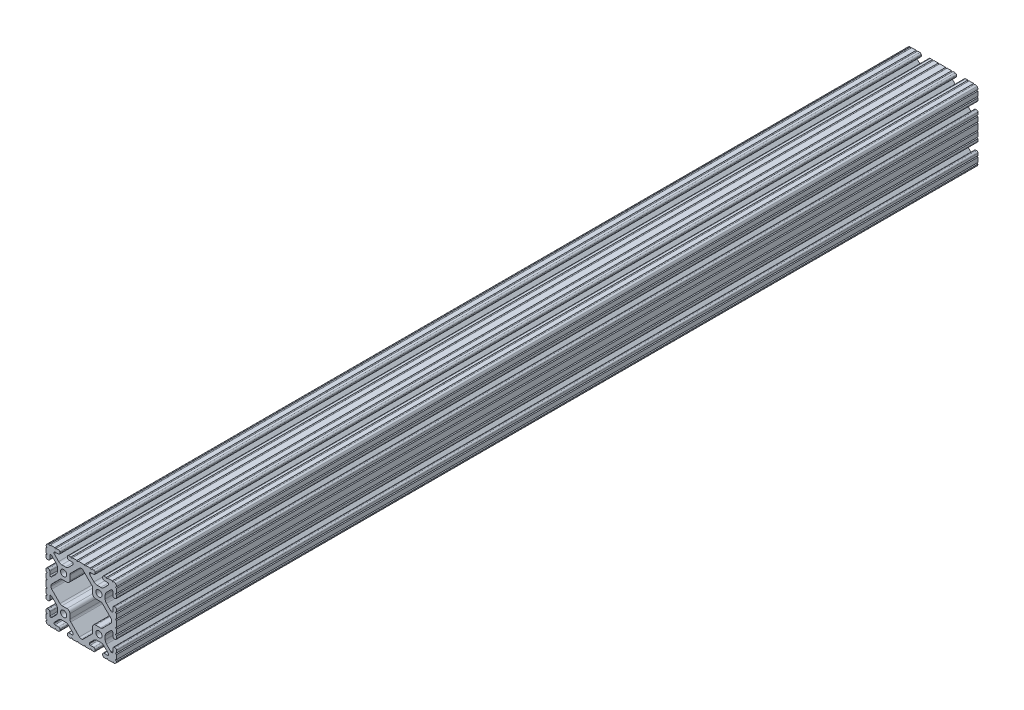
from build123d import *

# Parameters (mm, degrees)
BOSS_EXTRUDE1_DEPTH      = 465
BOSS_EXTRUDE1_DEPTH_BACK = 465
SKETCH3_R                = 3.3274


with BuildPart() as part:
    # Sketch3 → Boss-Extrude1 (new, two sides: drawn at the far end of the back side and taken through both)
    with BuildSketch(Plane.XY.offset(-BOSS_EXTRUDE1_DEPTH_BACK)):
        with BuildLine():
            Line((34.036, 28.448), (34.036, 24.630196049))
            ThreePointArc((34.036, 24.630196049), (34.497248241, 23.51664429), (35.6108, 23.055396049))
            Line((35.6108, 23.055396049), (36.525200183, 23.055396049))
            ThreePointArc((36.525200183, 23.055396049), (37.638751813, 23.516644236), (38.1, 24.630195866))
            Line((38.1, 24.630195866), (38.1, 27.023826138))
            ThreePointArc((38.1, 27.023826138), (37.117780706, 27.7845421), (38.1, 28.545258062))
            Line((38.1, 28.545258062), (38.1, 33.373016026))
            ThreePointArc((38.1, 33.373016026), (37.141472621, 34.109236774), (38.1, 34.845457521))
            ThreePointArc((38.1, 34.845457521), (37.837757813, 36.120195002), (37.086123144, 37.182631793))
            ThreePointArc((37.086123144, 37.182631793), (36.106286572, 37.843374398), (34.952681874, 38.1))
            ThreePointArc((34.952681874, 38.1), (34.190730434, 37.320215335), (33.428778994, 38.1))
            Line((33.428778994, 38.1), (28.601105935, 38.1))
            ThreePointArc((28.601105935, 38.1), (27.839158581, 37.32021942), (27.077211227, 38.1))
            Line((27.077211227, 38.1), (24.6888, 38.1))
            ThreePointArc((24.6888, 38.1), (23.575248241, 37.638751759), (23.114, 36.5252))
            Line((23.114, 36.5252), (23.114, 35.6108))
            ThreePointArc((23.114, 35.6108), (23.575248241, 34.497248241), (24.6888, 34.036))
            Line((24.6888, 34.036), (28.448, 34.036))
            ThreePointArc((28.448, 34.036), (29.076617928, 33.775617928), (29.337, 33.147))
            Line((29.337, 33.147), (29.337, 32.720693454))
            ThreePointArc((29.337, 32.720693454), (29.326675076, 32.273872751), (29.100231244, 31.888543625))
            Line((29.100231244, 31.888543625), (24.409287499, 27.197588341))
            ThreePointArc((24.409287499, 27.197588341), (22.868340045, 26.167958114), (21.050667579, 25.8064))
            Line((21.050667579, 25.8064), (17.049332421, 25.8064))
            ThreePointArc((17.049332421, 25.8064), (15.231659955, 26.167958114), (13.690712501, 27.197588341))
            Line((13.690712501, 27.197588341), (9.023381298, 31.864931024))
            ThreePointArc((9.023381298, 31.864931024), (8.830670886, 32.153343113), (8.763, 32.493548179))
            Line((8.763, 32.493548179), (8.763, 33.147))
            ThreePointArc((8.763, 33.147), (9.023382072, 33.775617928), (9.652, 34.036))
            Line((9.652, 34.036), (13.4112, 34.036))
            ThreePointArc((13.4112, 34.036), (14.524751759, 34.497248241), (14.986, 35.6108))
            Line((14.986, 35.6108), (14.986, 36.5252))
            ThreePointArc((14.986, 36.5252), (14.524751759, 37.638751759), (13.4112, 38.1))
            Line((13.4112, 38.1), (11.128867074, 38.1))
            ThreePointArc((11.128867074, 38.1), (10.367071033, 37.320370693), (9.605274992, 38.1))
            Line((9.605274992, 38.1), (4.777313069, 38.1))
            ThreePointArc((4.777313069, 38.1), (4.015517029, 37.320370693), (3.253720988, 38.1))
            Line((3.253720988, 38.1), (-3.253720988, 38.1))
            ThreePointArc((-3.253720988, 38.1), (-4.015517029, 37.320370693), (-4.777313069, 38.1))
            Line((-4.777313069, 38.1), (-9.605274992, 38.1))
            ThreePointArc((-9.605274992, 38.1), (-10.367071033, 37.320370693), (-11.128867074, 38.1))
            Line((-11.128867074, 38.1), (-13.4112, 38.1))
            ThreePointArc((-13.4112, 38.1), (-14.524751759, 37.638751759), (-14.986, 36.5252))
            Line((-14.986, 36.5252), (-14.986, 35.6108))
            ThreePointArc((-14.986, 35.6108), (-14.524751759, 34.497248241), (-13.4112, 34.036))
            Line((-13.4112, 34.036), (-9.652, 34.036))
            ThreePointArc((-9.652, 34.036), (-9.023382072, 33.775617928), (-8.763, 33.147))
            Line((-8.763, 33.147), (-8.763, 32.493548179))
            ThreePointArc((-8.763, 32.493548179), (-8.830670886, 32.153343113), (-9.023381298, 31.864931024))
            Line((-9.023381298, 31.864931024), (-13.690712501, 27.197588341))
            ThreePointArc((-13.690712501, 27.197588341), (-15.231659955, 26.167958114), (-17.049332421, 25.8064))
            Line((-17.049332421, 25.8064), (-21.050667579, 25.8064))
            ThreePointArc((-21.050667579, 25.8064), (-22.868340045, 26.167958114), (-24.409287499, 27.197588341))
            Line((-24.409287499, 27.197588341), (-29.100231244, 31.888543625))
            ThreePointArc((-29.100231244, 31.888543625), (-29.326675076, 32.273872751), (-29.337, 32.720693454))
            Line((-29.337, 32.720693454), (-29.337, 33.147))
            ThreePointArc((-29.337, 33.147), (-29.076617928, 33.775617928), (-28.448, 34.036))
            Line((-28.448, 34.036), (-24.6888, 34.036))
            ThreePointArc((-24.6888, 34.036), (-23.575248241, 34.497248241), (-23.114, 35.6108))
            Line((-23.114, 35.6108), (-23.114, 36.5252))
            ThreePointArc((-23.114, 36.5252), (-23.575248241, 37.638751759), (-24.6888, 38.1))
            Line((-24.6888, 38.1), (-27.077211227, 38.1))
            ThreePointArc((-27.077211227, 38.1), (-27.839158581, 37.32021942), (-28.601105935, 38.1))
            Line((-28.601105935, 38.1), (-33.428778994, 38.1))
            ThreePointArc((-33.428778994, 38.1), (-34.190730434, 37.320215335), (-34.952681874, 38.1))
            ThreePointArc((-34.952681874, 38.1), (-36.106286572, 37.843374398), (-37.086123144, 37.182631793))
            ThreePointArc((-37.086123144, 37.182631793), (-37.837757813, 36.120195002), (-38.1, 34.845457521))
            ThreePointArc((-38.1, 34.845457521), (-37.141472621, 34.109236774), (-38.1, 33.373016026))
            Line((-38.1, 33.373016026), (-38.1, 28.545258062))
            ThreePointArc((-38.1, 28.545258062), (-37.117780706, 27.7845421), (-38.1, 27.023826138))
            Line((-38.1, 27.023826138), (-38.1, 24.630195866))
            ThreePointArc((-38.1, 24.630195866), (-37.638751813, 23.516644236), (-36.525200183, 23.055396049))
            Line((-36.525200183, 23.055396049), (-35.6108, 23.055396049))
            ThreePointArc((-35.6108, 23.055396049), (-34.497248241, 23.51664429), (-34.036, 24.630196049))
            Line((-34.036, 24.630196049), (-34.036, 28.448))
            ThreePointArc((-34.036, 28.448), (-33.775617928, 29.076617928), (-33.147, 29.337))
            Line((-33.147, 29.337), (-32.664287242, 29.337))
            ThreePointArc((-32.664287242, 29.337), (-32.324081166, 29.269328695), (-32.03566854, 29.076617155))
            Line((-32.03566854, 29.076617155), (-27.19758008, 24.238516795))
            ThreePointArc((-27.19758008, 24.238516795), (-26.167955879, 22.697572205), (-25.8064, 20.879905136))
            Line((-25.8064, 20.879905136), (-25.8064, 17.220094864))
            ThreePointArc((-25.8064, 17.220094864), (-26.167955879, 15.402427795), (-27.19758008, 13.861483205))
            Line((-27.19758008, 13.861483205), (-31.948944541, 9.110107057))
            ThreePointArc((-31.948944541, 9.110107057), (-32.333417096, 8.853210196), (-32.786933649, 8.763))
            Line((-32.786933649, 8.763), (-33.060275787, 8.763))
            ThreePointArc((-33.060275787, 8.763), (-33.750216995, 9.048783005), (-34.036, 9.738724213))
            Line((-34.036, 9.738724213), (-34.036, 13.469803585))
            ThreePointArc((-34.036, 13.469803585), (-34.497248348, 14.583355603), (-35.610800366, 15.044603951))
            Line((-35.610800366, 15.044603951), (-36.5252, 15.044603951))
            ThreePointArc((-36.5252, 15.044603951), (-37.638751759, 14.58335571), (-38.1, 13.469803951))
            Line((-38.1, 13.469803951), (-38.1, 11.075039289))
            ThreePointArc((-38.1, 11.075039289), (-37.117000248, 10.313517272), (-38.1, 9.551995255))
            Line((-38.1, 9.551995255), (-38.1, 4.723759308))
            ThreePointArc((-38.1, 4.723759308), (-37.117000248, 3.962237292), (-38.1, 3.200715275))
            Line((-38.1, 3.200715275), (-38.1, -3.200715275))
            ThreePointArc((-38.1, -3.200715275), (-37.117000248, -3.962237292), (-38.1, -4.723759308))
            Line((-38.1, -4.723759308), (-38.1, -9.551995255))
            ThreePointArc((-38.1, -9.551995255), (-37.117000248, -10.313517272), (-38.1, -11.075039289))
            Line((-38.1, -11.075039289), (-38.1, -13.469803951))
            ThreePointArc((-38.1, -13.469803951), (-37.638751759, -14.58335571), (-36.5252, -15.044603951))
            Line((-36.5252, -15.044603951), (-35.610800366, -15.044603951))
            ThreePointArc((-35.610800366, -15.044603951), (-34.497248348, -14.583355603), (-34.036, -13.469803585))
            Line((-34.036, -13.469803585), (-34.036, -9.738724213))
            ThreePointArc((-34.036, -9.738724213), (-33.750216995, -9.048783005), (-33.060275787, -8.763))
            Line((-33.060275787, -8.763), (-32.786933649, -8.763))
            ThreePointArc((-32.786933649, -8.763), (-32.333417096, -8.853210196), (-31.948944541, -9.110107057))
            Line((-31.948944541, -9.110107057), (-27.19758008, -13.861483205))
            ThreePointArc((-27.19758008, -13.861483205), (-26.167955879, -15.402427795), (-25.8064, -17.220094864))
            Line((-25.8064, -17.220094864), (-25.8064, -20.879905136))
            ThreePointArc((-25.8064, -20.879905136), (-26.167955879, -22.697572205), (-27.19758008, -24.238516795))
            Line((-27.19758008, -24.238516795), (-32.03566854, -29.076617155))
            ThreePointArc((-32.03566854, -29.076617155), (-32.324081166, -29.269328695), (-32.664287242, -29.337))
            Line((-32.664287242, -29.337), (-33.147, -29.337))
            ThreePointArc((-33.147, -29.337), (-33.775617928, -29.076617928), (-34.036, -28.448))
            Line((-34.036, -28.448), (-34.036, -24.630196049))
            ThreePointArc((-34.036, -24.630196049), (-34.497248241, -23.51664429), (-35.6108, -23.055396049))
            Line((-35.6108, -23.055396049), (-36.525200183, -23.055396049))
            ThreePointArc((-36.525200183, -23.055396049), (-37.638751813, -23.516644236), (-38.1, -24.630195866))
            Line((-38.1, -24.630195866), (-38.1, -27.023826138))
            ThreePointArc((-38.1, -27.023826138), (-37.117780706, -27.7845421), (-38.1, -28.545258062))
            Line((-38.1, -28.545258062), (-38.1, -33.373016026))
            ThreePointArc((-38.1, -33.373016026), (-37.141472621, -34.109236774), (-38.1, -34.845457521))
            ThreePointArc((-38.1, -34.845457521), (-37.837757813, -36.120195002), (-37.086123144, -37.182631793))
            ThreePointArc((-37.086123144, -37.182631793), (-36.106286572, -37.843374398), (-34.952681874, -38.1))
            ThreePointArc((-34.952681874, -38.1), (-34.190730434, -37.320215335), (-33.428778994, -38.1))
            Line((-33.428778994, -38.1), (-28.601105935, -38.1))
            ThreePointArc((-28.601105935, -38.1), (-27.839158581, -37.32021942), (-27.077211227, -38.1))
            Line((-27.077211227, -38.1), (-24.6888, -38.1))
            ThreePointArc((-24.6888, -38.1), (-23.575248241, -37.638751759), (-23.114, -36.5252))
            Line((-23.114, -36.5252), (-23.114, -35.6108))
            ThreePointArc((-23.114, -35.6108), (-23.575248241, -34.497248241), (-24.6888, -34.036))
            Line((-24.6888, -34.036), (-28.448, -34.036))
            ThreePointArc((-28.448, -34.036), (-29.076617928, -33.775617928), (-29.337, -33.147))
            Line((-29.337, -33.147), (-29.337, -32.720693454))
            ThreePointArc((-29.337, -32.720693454), (-29.326675076, -32.273872751), (-29.100231244, -31.888543625))
            Line((-29.100231244, -31.888543625), (-24.409287499, -27.197588341))
            ThreePointArc((-24.409287499, -27.197588341), (-22.868340045, -26.167958114), (-21.050667579, -25.8064))
            Line((-21.050667579, -25.8064), (-17.049332421, -25.8064))
            ThreePointArc((-17.049332421, -25.8064), (-15.231659955, -26.167958114), (-13.690712501, -27.197588341))
            Line((-13.690712501, -27.197588341), (-9.023381298, -31.864931024))
            ThreePointArc((-9.023381298, -31.864931024), (-8.830670886, -32.153343113), (-8.763, -32.493548179))
            Line((-8.763, -32.493548179), (-8.763, -33.147))
            ThreePointArc((-8.763, -33.147), (-9.023382072, -33.775617928), (-9.652, -34.036))
            Line((-9.652, -34.036), (-13.4112, -34.036))
            ThreePointArc((-13.4112, -34.036), (-14.524751759, -34.497248241), (-14.986, -35.6108))
            Line((-14.986, -35.6108), (-14.986, -36.5252))
            ThreePointArc((-14.986, -36.5252), (-14.524751759, -37.638751759), (-13.4112, -38.1))
            Line((-13.4112, -38.1), (-11.128867074, -38.1))
            ThreePointArc((-11.128867074, -38.1), (-10.367071033, -37.320370693), (-9.605274992, -38.1))
            Line((-9.605274992, -38.1), (-4.777313069, -38.1))
            ThreePointArc((-4.777313069, -38.1), (-4.015517029, -37.320370693), (-3.253720988, -38.1))
            Line((-3.253720988, -38.1), (3.253720988, -38.1))
            ThreePointArc((3.253720988, -38.1), (4.015517029, -37.320370693), (4.777313069, -38.1))
            Line((4.777313069, -38.1), (9.605274992, -38.1))
            ThreePointArc((9.605274992, -38.1), (10.367071033, -37.320370693), (11.128867074, -38.1))
            Line((11.128867074, -38.1), (13.4112, -38.1))
            ThreePointArc((13.4112, -38.1), (14.524751759, -37.638751759), (14.986, -36.5252))
            Line((14.986, -36.5252), (14.986, -35.6108))
            ThreePointArc((14.986, -35.6108), (14.524751759, -34.497248241), (13.4112, -34.036))
            Line((13.4112, -34.036), (9.652, -34.036))
            ThreePointArc((9.652, -34.036), (9.023382072, -33.775617928), (8.763, -33.147))
            Line((8.763, -33.147), (8.763, -32.493548179))
            ThreePointArc((8.763, -32.493548179), (8.830670886, -32.153343113), (9.023381298, -31.864931024))
            Line((9.023381298, -31.864931024), (13.690712501, -27.197588341))
            ThreePointArc((13.690712501, -27.197588341), (15.231659955, -26.167958114), (17.049332421, -25.8064))
            Line((17.049332421, -25.8064), (21.050667579, -25.8064))
            ThreePointArc((21.050667579, -25.8064), (22.868340045, -26.167958114), (24.409287499, -27.197588341))
            Line((24.409287499, -27.197588341), (29.100231244, -31.888543625))
            ThreePointArc((29.100231244, -31.888543625), (29.326675076, -32.273872751), (29.337, -32.720693454))
            Line((29.337, -32.720693454), (29.337, -33.147))
            ThreePointArc((29.337, -33.147), (29.076617928, -33.775617928), (28.448, -34.036))
            Line((28.448, -34.036), (24.6888, -34.036))
            ThreePointArc((24.6888, -34.036), (23.575248241, -34.497248241), (23.114, -35.6108))
            Line((23.114, -35.6108), (23.114, -36.5252))
            ThreePointArc((23.114, -36.5252), (23.575248241, -37.638751759), (24.6888, -38.1))
            Line((24.6888, -38.1), (27.077211227, -38.1))
            ThreePointArc((27.077211227, -38.1), (27.839158581, -37.32021942), (28.601105935, -38.1))
            Line((28.601105935, -38.1), (33.428778994, -38.1))
            ThreePointArc((33.428778994, -38.1), (34.190730434, -37.320215335), (34.952681874, -38.1))
            ThreePointArc((34.952681874, -38.1), (36.106286572, -37.843374398), (37.086123144, -37.182631793))
            ThreePointArc((37.086123144, -37.182631793), (37.837757813, -36.120195002), (38.1, -34.845457521))
            ThreePointArc((38.1, -34.845457521), (37.141472621, -34.109236774), (38.1, -33.373016026))
            Line((38.1, -33.373016026), (38.1, -28.545258062))
            ThreePointArc((38.1, -28.545258062), (37.117780706, -27.7845421), (38.1, -27.023826138))
            Line((38.1, -27.023826138), (38.1, -24.630195866))
            ThreePointArc((38.1, -24.630195866), (37.638751813, -23.516644236), (36.525200183, -23.055396049))
            Line((36.525200183, -23.055396049), (35.6108, -23.055396049))
            ThreePointArc((35.6108, -23.055396049), (34.497248241, -23.51664429), (34.036, -24.630196049))
            Line((34.036, -24.630196049), (34.036, -28.448))
            ThreePointArc((34.036, -28.448), (33.775617928, -29.076617928), (33.147, -29.337))
            Line((33.147, -29.337), (32.664287242, -29.337))
            ThreePointArc((32.664287242, -29.337), (32.324081166, -29.269328695), (32.03566854, -29.076617155))
            Line((32.03566854, -29.076617155), (27.19758008, -24.238516795))
            ThreePointArc((27.19758008, -24.238516795), (26.167955879, -22.697572205), (25.8064, -20.879905136))
            Line((25.8064, -20.879905136), (25.8064, -17.220094864))
            ThreePointArc((25.8064, -17.220094864), (26.167955879, -15.402427795), (27.19758008, -13.861483205))
            Line((27.19758008, -13.861483205), (31.948944541, -9.110107057))
            ThreePointArc((31.948944541, -9.110107057), (32.333417096, -8.853210196), (32.786933649, -8.763))
            Line((32.786933649, -8.763), (33.060275787, -8.763))
            ThreePointArc((33.060275787, -8.763), (33.750216995, -9.048783005), (34.036, -9.738724213))
            Line((34.036, -9.738724213), (34.036, -13.469803585))
            ThreePointArc((34.036, -13.469803585), (34.497248348, -14.583355603), (35.610800366, -15.044603951))
            Line((35.610800366, -15.044603951), (36.5252, -15.044603951))
            ThreePointArc((36.5252, -15.044603951), (37.638751759, -14.58335571), (38.1, -13.469803951))
            Line((38.1, -13.469803951), (38.1, -11.075039289))
            ThreePointArc((38.1, -11.075039289), (37.117000248, -10.313517272), (38.1, -9.551995255))
            Line((38.1, -9.551995255), (38.1, -4.723759308))
            ThreePointArc((38.1, -4.723759308), (37.117000248, -3.962237292), (38.1, -3.200715275))
            Line((38.1, -3.200715275), (38.1, 3.200715275))
            ThreePointArc((38.1, 3.200715275), (37.117000248, 3.962237292), (38.1, 4.723759308))
            Line((38.1, 4.723759308), (38.1, 9.551995255))
            ThreePointArc((38.1, 9.551995255), (37.117000248, 10.313517272), (38.1, 11.075039289))
            Line((38.1, 11.075039289), (38.1, 13.469803951))
            ThreePointArc((38.1, 13.469803951), (37.638751759, 14.58335571), (36.5252, 15.044603951))
            Line((36.5252, 15.044603951), (35.610800366, 15.044603951))
            ThreePointArc((35.610800366, 15.044603951), (34.497248348, 14.583355603), (34.036, 13.469803585))
            Line((34.036, 13.469803585), (34.036, 9.738724213))
            ThreePointArc((34.036, 9.738724213), (33.750216995, 9.048783005), (33.060275787, 8.763))
            Line((33.060275787, 8.763), (32.786933649, 8.763))
            ThreePointArc((32.786933649, 8.763), (32.333417096, 8.853210196), (31.948944541, 9.110107057))
            Line((31.948944541, 9.110107057), (27.19758008, 13.861483205))
            ThreePointArc((27.19758008, 13.861483205), (26.167955879, 15.402427795), (25.8064, 17.220094864))
            Line((25.8064, 17.220094864), (25.8064, 20.879905136))
            ThreePointArc((25.8064, 20.879905136), (26.167955879, 22.697572205), (27.19758008, 24.238516795))
            Line((27.19758008, 24.238516795), (32.03566854, 29.076617155))
            ThreePointArc((32.03566854, 29.076617155), (32.324081166, 29.269328695), (32.664287242, 29.337))
            Line((32.664287242, 29.337), (33.147, 29.337))
            ThreePointArc((33.147, 29.337), (33.775617928, 29.076617928), (34.036, 28.448))
        make_face()
        with Locations((19.05, 19.05)):
            Circle(SKETCH3_R, mode=Mode.SUBTRACT)
        with Locations((-19.05, 19.05)):
            Circle(SKETCH3_R, mode=Mode.SUBTRACT)
        with Locations((19.05, -19.05)):
            Circle(SKETCH3_R, mode=Mode.SUBTRACT)
        with Locations((-19.05, -19.05)):
            Circle(SKETCH3_R, mode=Mode.SUBTRACT)
        with BuildLine():
            Line((-11.363666791, -22.843321003), (-2.051515952, -32.155494748))
            ThreePointArc((-2.051515952, -32.155494748), (-1.11031328, -32.786013752), (0, -33.011005091))
            ThreePointArc((0, -33.011005091), (1.11031328, -32.786013752), (2.051515952, -32.155494748))
            Line((2.051515952, -32.155494748), (11.363666791, -22.843321003))
            ThreePointArc((11.363666791, -22.843321003), (12.051918263, -21.813277828), (12.2936, -20.598259734))
            Line((12.2936, -20.598259734), (12.2936, -15.4686))
            ThreePointArc((12.2936, -15.4686), (13.22353597, -13.22353597), (15.4686, -12.2936))
            Line((15.4686, -12.2936), (20.769026744, -12.2936))
            ThreePointArc((20.769026744, -12.2936), (21.984048446, -12.051916769), (23.014093535, -11.363661269))
            Line((23.014093535, -11.363661269), (31.902125566, -2.475607377))
            ThreePointArc((31.902125566, -2.475607377), (32.607298578, -1.335259481), (32.728725173, 0))
            ThreePointArc((32.728725173, 0), (32.607298578, 1.335259481), (31.902125566, 2.475607377))
            Line((31.902125566, 2.475607377), (23.014093535, 11.363661269))
            ThreePointArc((23.014093535, 11.363661269), (21.984048446, 12.051916769), (20.769026744, 12.2936))
            Line((20.769026744, 12.2936), (15.4686, 12.2936))
            ThreePointArc((15.4686, 12.2936), (13.22353597, 13.22353597), (12.2936, 15.4686))
            Line((12.2936, 15.4686), (12.2936, 20.598259734))
            ThreePointArc((12.2936, 20.598259734), (12.051918263, 21.813277828), (11.363666791, 22.843321003))
            Line((11.363666791, 22.843321003), (2.051515952, 32.155494748))
            ThreePointArc((2.051515952, 32.155494748), (1.11031328, 32.786013752), (0, 33.011005091))
            ThreePointArc((0, 33.011005091), (-1.11031328, 32.786013752), (-2.051515952, 32.155494748))
            Line((-2.051515952, 32.155494748), (-11.363666791, 22.843321003))
            ThreePointArc((-11.363666791, 22.843321003), (-12.051918263, 21.813277828), (-12.2936, 20.598259734))
            Line((-12.2936, 20.598259734), (-12.2936, 15.4686))
            ThreePointArc((-12.2936, 15.4686), (-13.22353597, 13.22353597), (-15.4686, 12.2936))
            Line((-15.4686, 12.2936), (-20.769026744, 12.2936))
            ThreePointArc((-20.769026744, 12.2936), (-21.984048446, 12.051916769), (-23.014093535, 11.363661269))
            Line((-23.014093535, 11.363661269), (-31.902125566, 2.475607377))
            ThreePointArc((-31.902125566, 2.475607377), (-32.607298578, 1.335259481), (-32.728725173, 0))
            ThreePointArc((-32.728725173, 0), (-32.607298578, -1.335259481), (-31.902125566, -2.475607377))
            Line((-31.902125566, -2.475607377), (-23.014093535, -11.363661269))
            ThreePointArc((-23.014093535, -11.363661269), (-21.984048446, -12.051916769), (-20.769026744, -12.2936))
            Line((-20.769026744, -12.2936), (-15.4686, -12.2936))
            ThreePointArc((-15.4686, -12.2936), (-13.22353597, -13.22353597), (-12.2936, -15.4686))
            Line((-12.2936, -15.4686), (-12.2936, -20.598259734))
            ThreePointArc((-12.2936, -20.598259734), (-12.051918263, -21.813277828), (-11.363666791, -22.843321003))
        make_face(mode=Mode.SUBTRACT)
    extrude(amount=BOSS_EXTRUDE1_DEPTH + BOSS_EXTRUDE1_DEPTH_BACK)


solid = part.part
